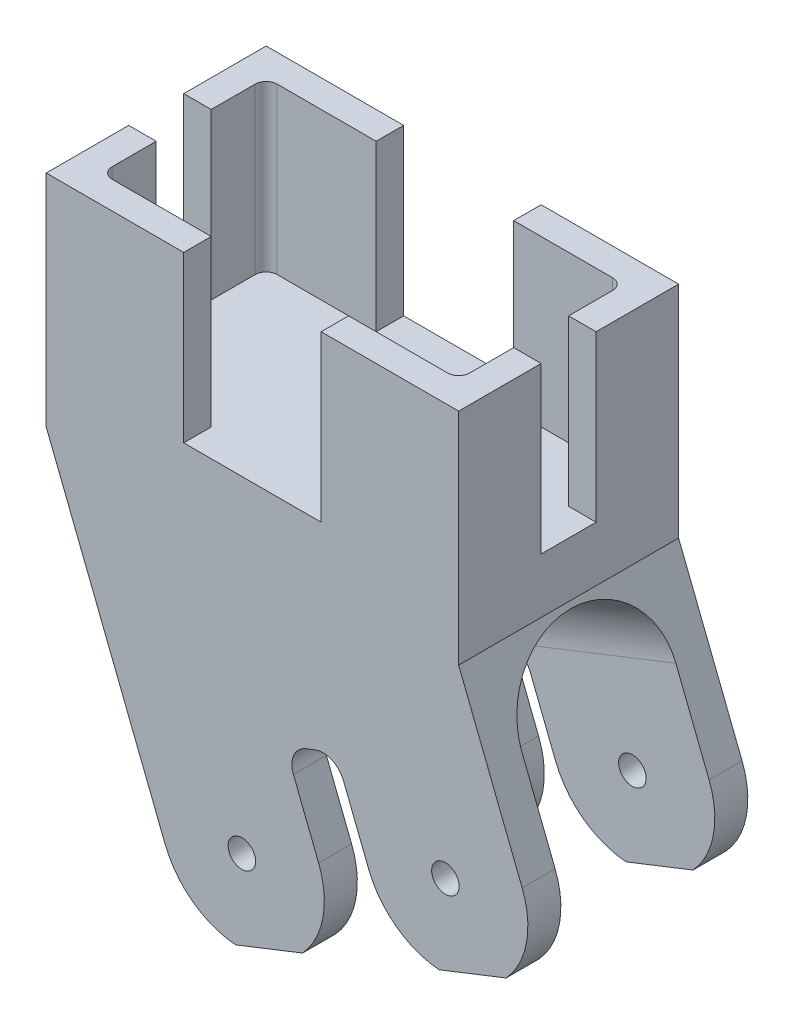
from build123d import *

# Parameters (mm, degrees)
SKETCH_1_W               = 75
SKETCH_1_H               = 40
EXTRUDE_1_DEPTH          = 10
SKETCH_2_W               = 75
SKETCH_2_H               = 40
SKETCH_2_W_2             = 65
SKETCH_2_H_2             = 30
EXTRUDE_2_DEPTH          = 30
FILLET_2_R               = 2
SKETCH_3_W               = 5
SKETCH_3_H               = 5
CUT_EXTRUDE_1_DEPTH      = 30
EXTRUDE_3_REACH          = 72.682
SKETCH_4_W               = 40
SKETCH_4_H               = 69.781317598
SKETCH_5_W               = 69.781317598
SKETCH_5_H               = 40
EXTRUDE_4_DEPTH          = 45
CUT_EXTRUDE_2_DEPTH      = 109.313665007
CUT_EXTRUDE_3_DEPTH      = 93.843161337
CUT_EXTRUDE_3_DEPTH_BACK = 93.843161337
SKETCH_9_R               = 2.5
CUT_EXTRUDE_4_DEPTH      = 93.843161337
CUT_EXTRUDE_4_DEPTH_BACK = 93.843161337
FILLET_3_R               = 4
SKETCH_14_W              = 25
SKETCH_14_H              = 5
CUT_EXTRUDE_5_DEPTH      = 30


with BuildPart() as part:
    # 草图1 → 凸台-拉伸1 (new body)
    with BuildSketch(Plane(origin=(0, 0, 0), x_dir=(1, 0, 0), z_dir=(0, 1, 0))):
        Rectangle(SKETCH_1_W, SKETCH_1_H)
    extrude(amount=EXTRUDE_1_DEPTH)

    # 草图2 → 凸台-拉伸2 (add)
    with BuildSketch(Plane(origin=(0, 10, 0), x_dir=(1, 0, 0), z_dir=(0, 1, 0))):
        Rectangle(SKETCH_2_W, SKETCH_2_H)
        Rectangle(SKETCH_2_W_2, SKETCH_2_H_2, mode=Mode.SUBTRACT)
    extrude(amount=EXTRUDE_2_DEPTH)

    # 圆角2
    fillet_2_edges = [part.edges().sort_by_distance(p)[0] for p in [
        (32.5, 25, -15),
        (-32.5, 25, -15),
        (-32.5, 25, 15),
        (32.5, 25, 15),
    ]]
    fillet(fillet_2_edges, radius=FILLET_2_R)

    # 草图3 → 切除-拉伸1 (cut)
    with BuildSketch(Plane(origin=(0, 40, 0), x_dir=(1, 0, 0), z_dir=(0, 1, 0))):
        with Locations((-35, -2.5)):
            Rectangle(SKETCH_3_W, SKETCH_3_H)
        with Locations((-35, 2.5)):
            Rectangle(SKETCH_3_W, SKETCH_3_H)
        with Locations((35, -2.5)):
            Rectangle(SKETCH_3_W, SKETCH_3_H)
        with Locations((35, 2.5)):
            Rectangle(SKETCH_3_W, SKETCH_3_H)
    extrude(amount=-CUT_EXTRUDE_1_DEPTH, mode=Mode.SUBTRACT)

    # 凸台-拉伸3: up to this face of the body (flat: up to its plane)
    extrude_3_end = Plane(part.part.faces().sort_by_distance((0, 0, 0))[0])
    # 草图4 → 凸台-拉伸3 (add, up to the picked face)
    with BuildSketch(Plane(origin=(5.037118095, -12.787469251, 0), x_dir=(0, 0, -1), z_dir=(0.3665012267242981, -0.9304175679820242, 0)), mode=Mode.PRIVATE) as extrude_3_sk1:
        Rectangle(SKETCH_4_W, SKETCH_4_H)
    extrude_3_tool1 = split(extrude(extrude_3_sk1.sketch, amount=-EXTRUDE_3_REACH, mode=Mode.PRIVATE), bisect_by=extrude_3_end, keep=Keep.BOTH, mode=Mode.PRIVATE)
    add(extrude_3_tool1.solids().sort_by(Axis((5.037118, -12.787469, 0), (-0.3665012267242981, 0.9304175679820242, 0)))[0])

    # 草图5 → 凸台-拉伸4 (add)
    with BuildSketch(Plane(origin=(5.037118095, -12.787469251, 0), x_dir=(0.9304175679820242, 0.36650122672429813, 0), z_dir=(0.36650122672429813, -0.9304175679820244, 0))):
        Rectangle(SKETCH_5_W, SKETCH_5_H)
    extrude(amount=EXTRUDE_4_DEPTH)

    # 草图7 → 切除-拉伸2 (cut, through all)
    with BuildSketch(Plane(origin=(32.462881905, 12.787469251, 0), x_dir=(0, 0, -1), z_dir=(0.9304175679820242, 0.3665012267242982, 0))):
        with BuildLine():
            ThreePointArc((14, -28.743796002), (0, -14.743796002), (-14, -28.743796002))
            Line((-14, -28.743796002), (-14, -58.743796002))
            Line((-14, -58.743796002), (14, -58.743796002))
            Line((14, -58.743796002), (14, -28.743796002))
        make_face()
    extrude(amount=-CUT_EXTRUDE_2_DEPTH, mode=Mode.SUBTRACT)

    # 草图9 → 切除-拉伸3 (cut, two sides: drawn at the far end of the back side and taken through both)
    with BuildSketch(Plane.XY.offset(-14).offset(-CUT_EXTRUDE_3_DEPTH_BACK)):
        with Locations((-1.924711649, -49.385573493)):
            Circle(SKETCH_9_R)
        with Locations((35.088525122, -34.805671792)):
            Circle(SKETCH_9_R)
    extrude(amount=CUT_EXTRUDE_3_DEPTH + CUT_EXTRUDE_3_DEPTH_BACK, mode=Mode.SUBTRACT)

    # 草图11 → 切除-拉伸4 (cut, two sides: drawn at the far end of the back side and taken through both)
    with BuildSketch(Plane.XY.offset(-14).offset(-CUT_EXTRUDE_4_DEPTH_BACK)):
        with BuildLine():
            Line((5.98428163, -28.53616522), (12.031551871, -43.888055092))
            ThreePointArc((12.031551871, -43.888055092), (12.812044317, -46.587712953), (13.075288351, -49.385573493))
            ThreePointArc((13.075288351, -49.385573493), (12.047893904, -54.84142302), (9.106449143, -59.549897946))
            Line((9.106449143, -59.549897946), (33.952897452, -49.762621675))
            ThreePointArc((33.952897452, -49.762621675), (26.182824368, -46.875820676), (21.132261602, -40.303190193))
            Line((21.132261602, -40.303190193), (15.084991361, -24.951300321))
            Line((15.084991361, -24.951300321), (5.98428163, -28.53616522))
        make_face()
        with BuildLine():
            ThreePointArc((-3.06033932, -64.342523376), (-10.830412504, -61.455722303), (-15.880975261, -54.883091661))
            Line((-15.880975261, -54.883091661), (-10.933208608, -67.443729062))
            Line((-10.933208608, -67.443729062), (-3.06033932, -64.342523376))
        make_face()
        with BuildLine():
            Line((53.992555203, -41.868790559), (49.044788748, -29.308153662))
            ThreePointArc((49.044788748, -29.308153662), (49.825281115, -32.007811395), (50.088525122, -34.805671792))
            ThreePointArc((50.088525122, -34.805671792), (49.061130675, -40.261521319), (46.119685914, -44.969996245))
            Line((46.119685914, -44.969996245), (53.992555203, -41.868790559))
        make_face()
    extrude(amount=CUT_EXTRUDE_4_DEPTH + CUT_EXTRUDE_4_DEPTH_BACK, mode=Mode.SUBTRACT)

    # 圆角3
    fillet_3_edges = [part.edges().sort_by_distance(p)[0] for p in [
        (5.98428163, -28.53616522, 17),
        (5.98428163, -28.53616522, -17),
        (15.084991361, -24.951300321, 17),
        (15.084991361, -24.951300321, -17),
    ]]
    fillet(fillet_3_edges, radius=FILLET_3_R)

    # 草图14 → 切除-拉伸5 (cut)
    with BuildSketch(Plane(origin=(0, 40, 0), x_dir=(1, 0, 0), z_dir=(0, 1, 0))):
        with Locations((0, -17.5)):
            Rectangle(SKETCH_14_W, SKETCH_14_H)
    cut_extrude_5 = extrude(amount=-CUT_EXTRUDE_5_DEPTH, mode=Mode.SUBTRACT)

    # 镜向1: 切除-拉伸5 across plane
    add(cut_extrude_5.mirror(Plane.XY), mode=Mode.SUBTRACT)


solid = part.part
